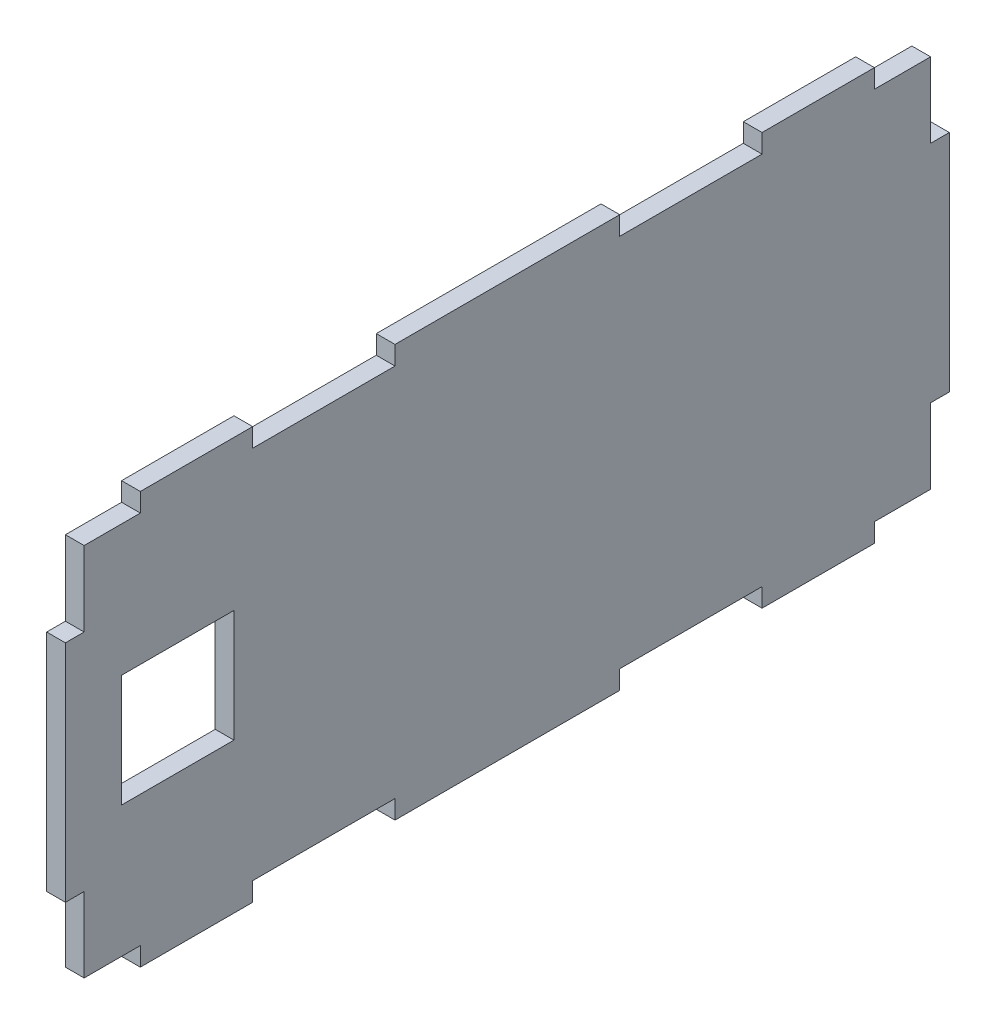
from build123d import *

# Parameters (mm, degrees)
SKETCH1_W           = 226
SKETCH1_H           = 100
SKETCH1_W_2         = 30
SKETCH1_H_2         = 30
SKETCH1_W_3         = 5
SKETCH1_H_3         = 60
SKETCH1_H_4         = 5
SKETCH1_W_4         = 60
BOSS_EXTRUDE1_DEPTH = 5


with BuildPart() as part:
    # Sketch1 → Boss-Extrude1 (new body)
    # profile 1 of 9: a face of its own
    with BuildSketch(Plane(origin=(0, 0, 0), x_dir=(0, 0, -1), z_dir=(1, 0, 0))):
        Rectangle(SKETCH1_W, SKETCH1_H)
        with Locations((-88, 0)):
            Rectangle(SKETCH1_W_2, SKETCH1_H_2, mode=Mode.SUBTRACT)
    # profile 2 of 9: a face of its own
    with BuildSketch(Plane(origin=(0, 0, 0), x_dir=(0, 0, -1), z_dir=(1, 0, 0))):
        with Locations((115.5, 0)):
            Rectangle(SKETCH1_W_3, SKETCH1_H_3)
    # profile 3 of 9: a face of its own
    with BuildSketch(Plane(origin=(0, 0, 0), x_dir=(0, 0, -1), z_dir=(1, 0, 0))):
        with Locations((83, 52.5)):
            Rectangle(SKETCH1_W_2, SKETCH1_H_4)
    # profile 4 of 9: a face of its own
    with BuildSketch(Plane(origin=(0, 0, 0), x_dir=(0, 0, -1), z_dir=(1, 0, 0))):
        with Locations((0, 52.5)):
            Rectangle(SKETCH1_W_4, SKETCH1_H_4)
    # profile 5 of 9: a face of its own
    with BuildSketch(Plane(origin=(0, 0, 0), x_dir=(0, 0, -1), z_dir=(1, 0, 0))):
        with Locations((83, -52.5)):
            Rectangle(SKETCH1_W_2, SKETCH1_H_4)
    # profile 6 of 9: a face of its own
    with BuildSketch(Plane(origin=(0, 0, 0), x_dir=(0, 0, -1), z_dir=(1, 0, 0))):
        with Locations((0, -52.5)):
            Rectangle(SKETCH1_W_4, SKETCH1_H_4)
    # profile 7 of 9: a face of its own
    with BuildSketch(Plane(origin=(0, 0, 0), x_dir=(0, 0, -1), z_dir=(1, 0, 0))):
        with Locations((-83, -52.5)):
            Rectangle(SKETCH1_W_2, SKETCH1_H_4)
    # profile 8 of 9: a face of its own
    with BuildSketch(Plane(origin=(0, 0, 0), x_dir=(0, 0, -1), z_dir=(1, 0, 0))):
        with Locations((-115.5, 0)):
            Rectangle(SKETCH1_W_3, SKETCH1_H_3)
    # profile 9 of 9: a face of its own
    with BuildSketch(Plane(origin=(0, 0, 0), x_dir=(0, 0, -1), z_dir=(1, 0, 0))):
        with Locations((-83, 52.5)):
            Rectangle(SKETCH1_W_2, SKETCH1_H_4)
    extrude(amount=BOSS_EXTRUDE1_DEPTH)


solid = part.part
